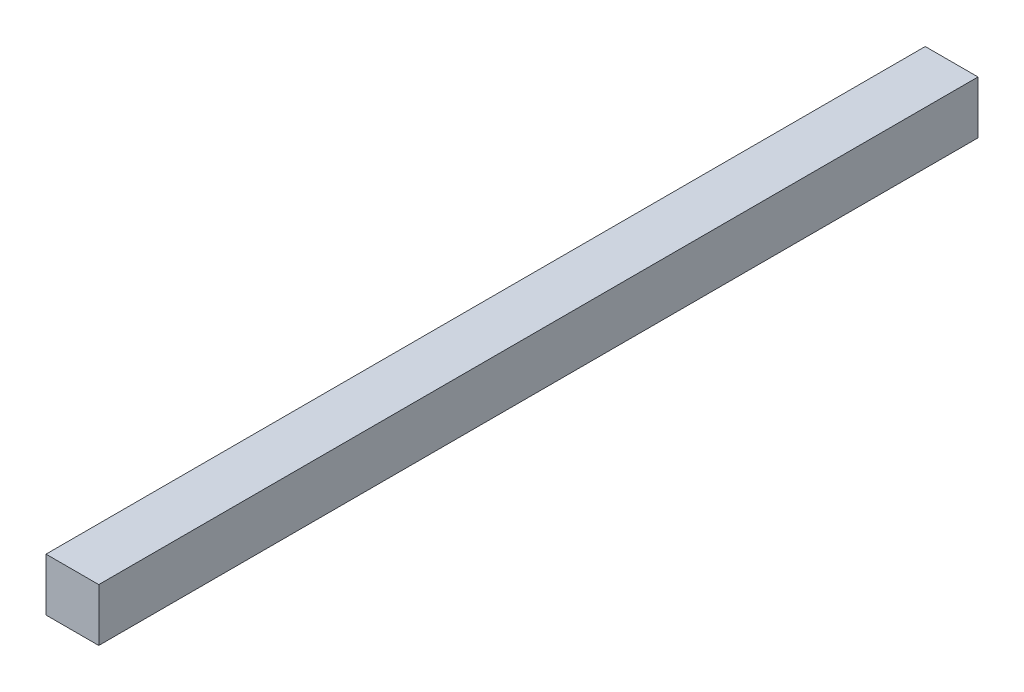
from build123d import *

# Parameters (mm, degrees)
SKETCH1_W           = 30
SKETCH1_H           = 30
BOSS_EXTRUDE1_DEPTH = 500


with BuildPart() as part:
    # Sketch1 → Boss-Extrude1 (new body)
    with BuildSketch(Plane.XY):
        with Locations((-4.576235094, 7.717206133)):
            Rectangle(SKETCH1_W, SKETCH1_H)
    extrude(amount=BOSS_EXTRUDE1_DEPTH)


solid = part.part
